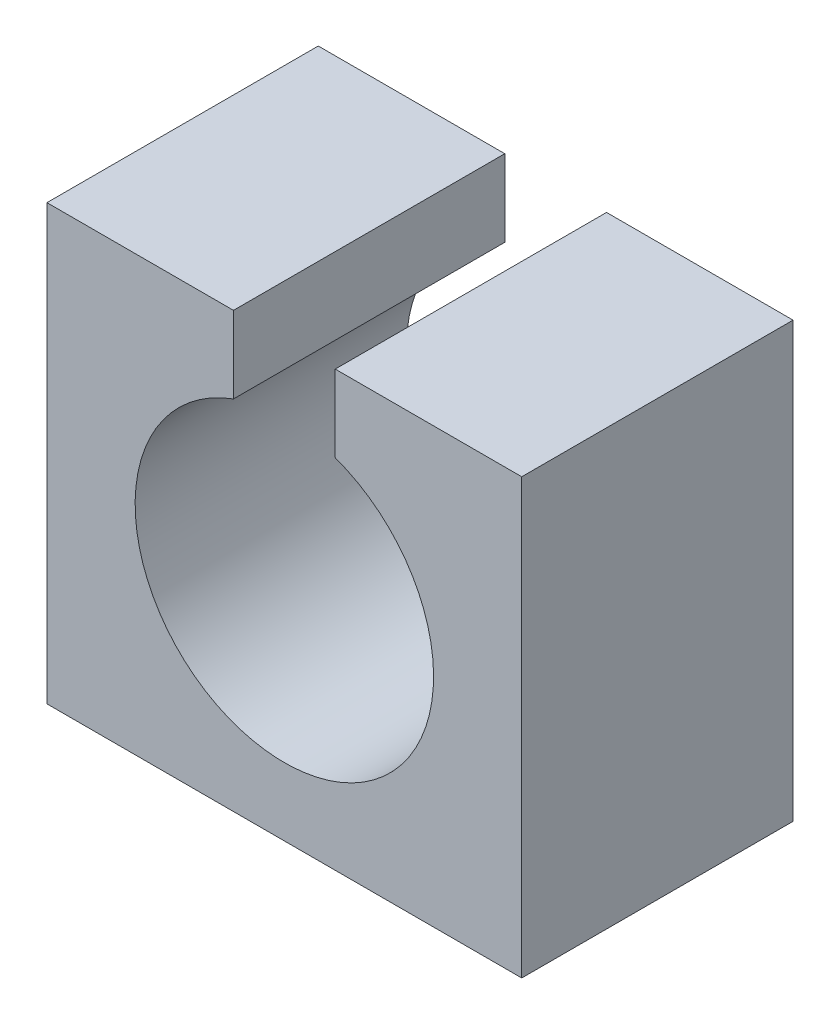
from build123d import *

# Parameters (mm, degrees)
SKETCH_1_W          = 70
SKETCH_1_H          = 64
EXTRUDE_1_DEPTH     = 20
SKETCH_2_R          = 22
CUT_EXTRUDE_1_DEPTH = 40
SKETCH_3_W          = 15
SKETCH_3_H          = 40
CUT_EXTRUDE_2_DEPTH = 20


with BuildPart() as part:
    # 草图1 → 凸台-拉伸1 (new, symmetric)
    with BuildSketch(Plane.XY):
        Rectangle(SKETCH_1_W, SKETCH_1_H)
    extrude(amount=EXTRUDE_1_DEPTH, both=True)

    # 草图2 → 切除-拉伸1 (cut)
    with BuildSketch(Plane.XY.offset(20)):
        Circle(SKETCH_2_R)
    extrude(amount=-CUT_EXTRUDE_1_DEPTH, mode=Mode.SUBTRACT)

    # 草图3 → 切除-拉伸2 (cut)
    with BuildSketch(Plane(origin=(0, 32, 0), x_dir=(1, 0, 0), z_dir=(0, 1, 0))):
        Rectangle(SKETCH_3_W, SKETCH_3_H)
    extrude(amount=-CUT_EXTRUDE_2_DEPTH, mode=Mode.SUBTRACT)


solid = part.part
